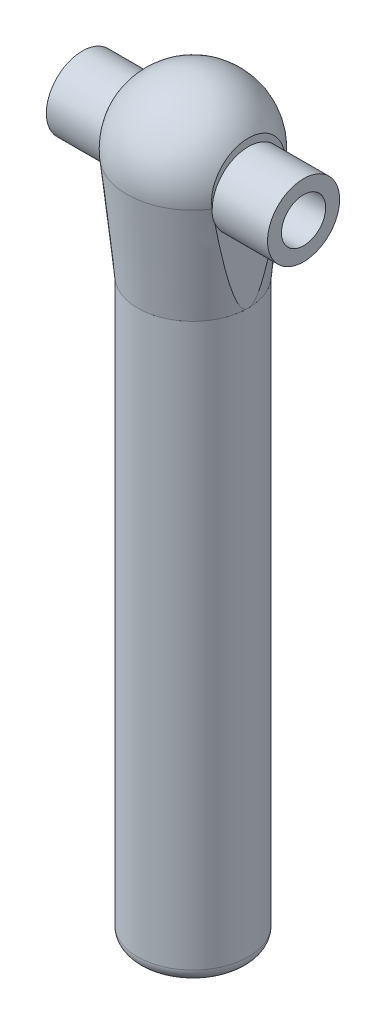
from build123d import *

# Parameters (mm, degrees)
SZKIC1_R                         = 12.5
DODANIE_WYCI_GNI_CIE1_DEPTH      = 130
SZKIC3_W                         = 5
SZKIC3_H                         = 30
WYTNIJ_WYCI_GNI_CIE1_DEPTH       = 172.31841699
SZKIC4_R                         = 5
WYTNIJ_WYCI_GNI_CIE2_DEPTH       = 173.481883107
SZKIC5_R                         = 5
WYTNIJ_WYCI_GNI_CIE3_DEPTH       = 130
ZAOKR_GLENIE1_R                  = 3
DODANIE_WYCI_GNI_CIE2_DEPTH      = 25
DODANIE_WYCI_GNI_CIE2_DEPTH_BACK = 25
SZKIC6_R                         = 8.147367488
SZKIC6_R_2                       = 5


with BuildPart() as part:
    # Szkic1 → Dodanie-wyciągnięcie1 (new body)
    with BuildSketch(Plane(origin=(0, 0, 0), x_dir=(1, 0, 0), z_dir=(0, 1, 0))):
        with Locations(Location((0, 0, 0), (0, 0, 270))):
            Circle(SZKIC1_R)
    extrude(amount=DODANIE_WYCI_GNI_CIE1_DEPTH)

    # Szkic5 → Wytnij-wyciągnięcie3 (cut)
    with BuildSketch(Plane.XZ):
        with Locations(Location((0, 0, 0), (0, 0, 270))):
            Circle(SZKIC5_R)
    extrude(amount=-WYTNIJ_WYCI_GNI_CIE3_DEPTH, mode=Mode.SUBTRACT)

    # Zaokrąglenie1
    zaokr_glenie1_edges = [part.edges().sort_by_distance(p)[0] for p in [
        (0, 0, -12.5),
        (0, 0, 5),
    ]]
    fillet(zaokr_glenie1_edges, radius=ZAOKR_GLENIE1_R)


with BuildPart() as body_2:
    # Szkic2 → Obrót1 (revolve)
    with BuildSketch(Plane(origin=(0, 0, 0), x_dir=(0, 0, -1), z_dir=(1, 0, 0)), mode=Mode.PRIVATE) as obr_t1_sk:
        with BuildLine():
            ThreePointArc((0, 170), (15, 155), (0, 140))
            Line((0, 140), (0, 170))
        make_face()
        with BuildLine():
            Line((0, 130), (12.5, 130))
            Line((12.5, 130), (14.920777358, 153.460388679))
            ThreePointArc((14.920777358, 153.460388679), (10.047532786, 143.8623573), (0, 140))
            Line((0, 140), (0, 130))
        make_face()
    revolve(obr_t1_sk.sketch.rotate(Axis((0, 182.123097576, 0), (0, -1, 0)), 180), axis=Axis((0, 182.123097576, 0), (0, -1, 0)))

    # Szkic3 → Wytnij-wyciągnięcie1 (cut, through all)
    with BuildSketch(Plane.XZ):
        with Locations((-15, 0)):
            Rectangle(SZKIC3_W, SZKIC3_H)
        with Locations((15, 0)):
            Rectangle(SZKIC3_W, SZKIC3_H)
    extrude(amount=-WYTNIJ_WYCI_GNI_CIE1_DEPTH, mode=Mode.SUBTRACT)

    # Szkic4 → Wytnij-wyciągnięcie2 (cut, through all)
    with BuildSketch(Plane(origin=(12.5, 0, 0), x_dir=(0, 0, -1), z_dir=(1, 0, 0))):
        with Locations((0, 153.460388679)):
            Circle(SZKIC4_R)
    extrude(amount=-WYTNIJ_WYCI_GNI_CIE2_DEPTH, mode=Mode.SUBTRACT)

    # Szkic6 → Dodanie-wyciągnięcie2 (add, two sides: drawn at the far end of the back side and taken through both)
    with BuildSketch(Plane(origin=(0, 0, 0), x_dir=(0, 0, -1), z_dir=(1, 0, 0)).offset(-DODANIE_WYCI_GNI_CIE2_DEPTH_BACK)):
        with Locations((0, 153.460388679)):
            Circle(SZKIC6_R)
        with Locations((0, 153.460388679)):
            Circle(SZKIC6_R_2, mode=Mode.SUBTRACT)
    extrude(amount=DODANIE_WYCI_GNI_CIE2_DEPTH + DODANIE_WYCI_GNI_CIE2_DEPTH_BACK)


solid = Compound([part.part, body_2.part])
